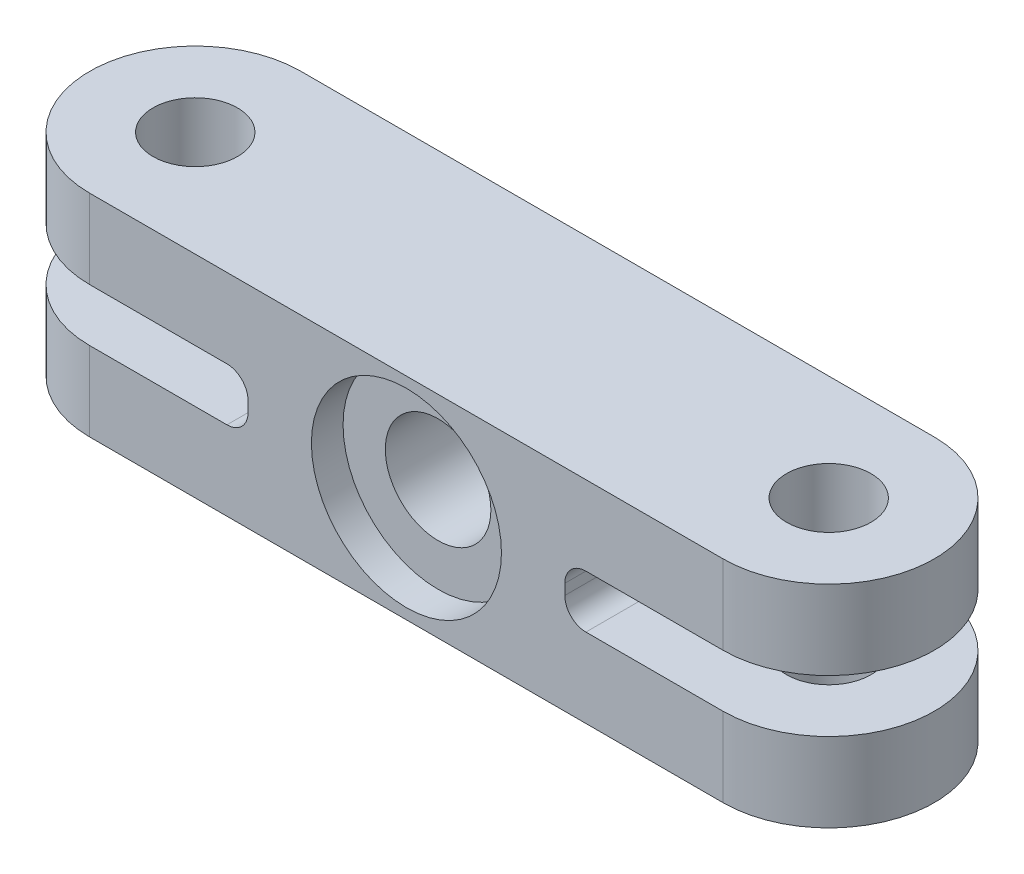
from build123d import *

# Parameters (mm, degrees)
SKETCH1_R           = 4
BOSS_EXTRUDE1_DEPTH = 20
CUT_EXTRUDE1_DEPTH  = 20
SKETCH3_R           = 5
CUT_EXTRUDE2_DEPTH  = 20
SKETCH3_3_R         = 9
CUT_EXTRUDE3_DEPTH  = 3


with BuildPart() as part:
    # Sketch1 → Boss-Extrude1 (new body)
    with BuildSketch(Plane(origin=(0, 0, 0), x_dir=(1, 0, 0), z_dir=(0, 1, 0))):
        with BuildLine():
            Line((-30, -10), (30, -10))
            ThreePointArc((30, -10), (40, 0), (30, 10))
            Line((30, 10), (-30, 10))
            ThreePointArc((-30, 10), (-40, 0), (-30, -10))
        make_face()
        with Locations((-30, 0)):
            Circle(SKETCH1_R, mode=Mode.SUBTRACT)
        with Locations((30, 0)):
            Circle(SKETCH1_R, mode=Mode.SUBTRACT)
    extrude(amount=BOSS_EXTRUDE1_DEPTH)

    # Sketch2 → Cut-Extrude1 (cut)
    with BuildSketch(Plane.XY.offset(10)):
        with BuildLine():
            Line((-40, 12.5), (-17, 12.5))
            ThreePointArc((-17, 12.5), (-15.585786438, 11.914213562), (-15, 10.5))
            Line((-15, 10.5), (-15, 9.5))
            ThreePointArc((-15, 9.5), (-15.585786438, 8.085786438), (-17, 7.5))
            Line((-17, 7.5), (-40, 7.5))
            Line((-40, 7.5), (-40, 12.5))
        make_face()
        with BuildLine():
            Line((40, 7.5), (40, 12.5))
            Line((40, 12.5), (17, 12.5))
            ThreePointArc((17, 12.5), (15.585786438, 11.914213562), (15, 10.5))
            Line((15, 10.5), (15, 9.5))
            ThreePointArc((15, 9.5), (15.585786438, 8.085786438), (17, 7.5))
            Line((17, 7.5), (40, 7.5))
        make_face()
    extrude(amount=-CUT_EXTRUDE1_DEPTH, mode=Mode.SUBTRACT)

    # Sketch3 → Cut-Extrude2 (cut)
    with BuildSketch(Plane.XY.offset(10)):
        with Locations((0, 10)):
            Circle(SKETCH3_R)
    extrude(amount=-CUT_EXTRUDE2_DEPTH, mode=Mode.SUBTRACT)

    # Sketch3<3> → Cut-Extrude3 (cut)
    with BuildSketch(Plane.XY.offset(10)):
        with Locations((0, 10)):
            Circle(SKETCH3_3_R)
    extrude(amount=-CUT_EXTRUDE3_DEPTH, mode=Mode.SUBTRACT)


solid = part.part
